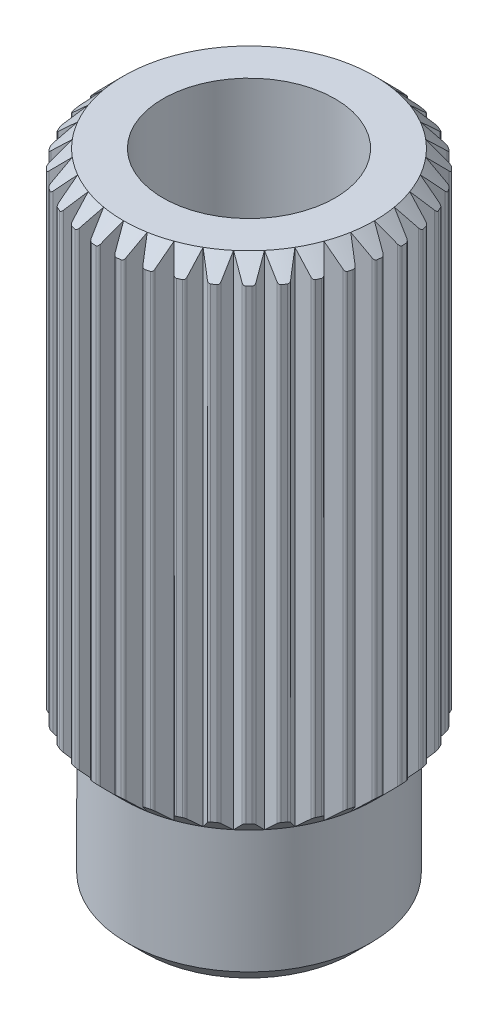
from build123d import *

# Parameters (mm, degrees)
SKETCH1_R                = 5
SKETCH1_R_2              = 3
BOSS_EXTRUDE1_DEPTH      = 22.5
SKETCH2_R                = 5
SKETCH2_R_2              = 4.25
CUT_EXTRUDE1_DEPTH       = 5
CHAMFER1_SIZE            = 0.625
CUT_EXTRUDE2_REACH       = 25.585
FILLET1_R                = 0.1
CIRPATTERN2_COUNT        = 36
FILLET1_OF_CIRPATTERN2_R = 0.1


with BuildPart() as part:
    # Sketch1 → Boss-Extrude1 (new body)
    with BuildSketch(Plane(origin=(0, 0, 0), x_dir=(1, 0, 0), z_dir=(0, 1, 0))):
        with Locations(Location((0, 0, 0), (0, 0, 90))):
            Circle(SKETCH1_R)
        with Locations(Location((0, 0, 0), (0, 0, 90))):
            Circle(SKETCH1_R_2, mode=Mode.SUBTRACT)
    extrude(amount=BOSS_EXTRUDE1_DEPTH)

    # Sketch2 → Cut-Extrude1 (cut)
    with BuildSketch(Plane.XZ):
        with Locations(Location((0, 0, 0), (0, 0, 270))):
            Circle(SKETCH2_R)
        with Locations(Location((0, 0, 0), (0, 0, 270))):
            Circle(SKETCH2_R_2, mode=Mode.SUBTRACT)
    extrude(amount=-CUT_EXTRUDE1_DEPTH, mode=Mode.SUBTRACT)

    # Chamfer1
    chamfer1_edges = [part.edges().sort_by_distance(p)[0] for p in [
        (0, 5, 5),
        (0, 0, 4.25),
        (0, 22.5, 5),
    ]]
    chamfer(chamfer1_edges, length=CHAMFER1_SIZE)

    # Cut-Extrude2: up to this cone (the profile starts inside it)
    cut_extrude2_end = Plane(origin=(0, 22.5, 0), z_dir=(0, 1, 0)).offset(-21.874999) * Cone(1e-06, 69.835, 69.834999, align=(Align.CENTER, Align.CENTER, Align.MIN), mode=Mode.PRIVATE)
    # Sketch3 → Cut-Extrude2 (cut, up to the surface)
    with BuildSketch(Plane(origin=(0, 22.5, 0), x_dir=(1, 0, 0), z_dir=(0, 1, 0)), mode=Mode.PRIVATE) as cut_extrude2_sk1:
        Polygon((0, 4.375), (0.329013253, 5.080571197), (-0.329013253, 5.080571197), align=None)
    cut_extrude2_tool1 = extrude(cut_extrude2_sk1.sketch, amount=-CUT_EXTRUDE2_REACH, mode=Mode.PRIVATE) & cut_extrude2_end
    cut_extrude2 = cut_extrude2_tool1.solids().sort_by_distance((0, 22.5, -4.845381))[0]
    add(cut_extrude2, mode=Mode.SUBTRACT)

    # Fillet1
    fillet1_edges = [part.edges().sort_by_distance(p)[0] for p in [
        (-0.287582554, 13.75, -4.991722776),
        (0.287582554, 13.75, -4.991722776),
    ]]
    fillet(fillet1_edges, radius=FILLET1_R)

    # CirPattern2: Cut-Extrude2 ×36 about axis
    cirpattern2_axis = Axis((0, 0, 0), (0, 1, 0))
    for i in range(1, CIRPATTERN2_COUNT):
        add(cut_extrude2.rotate(cirpattern2_axis, i * 360 / CIRPATTERN2_COUNT), mode=Mode.SUBTRACT)

    # Fillet1 of CirPattern2
    fillet1_of_cirpattern2_edges = [part.edges().sort_by_distance(p)[0] for p in [
        (-1.150017092, 13.75, -4.865949105),
        (-0.583590035, 13.75, -4.965825477),
        (-1.977508943, 13.75, -4.592326032),
        (-1.437030536, 13.75, -4.789044084),
        (-2.744915185, 13.75, -4.179167456),
        (-2.246807591, 13.75, -4.46675001),
        (-3.428918569, 13.75, -3.639026992),
        (-2.988316534, 13.75, -4.008735997),
        (-4.008735997, 13.75, -2.988316534),
        (-3.639026992, 13.75, -3.428918569),
        (-4.46675001, 13.75, -2.246807591),
        (-4.179167456, 13.75, -2.744915185),
        (-4.789044084, 13.75, -1.437030536),
        (-4.592326032, 13.75, -1.977508943),
        (-4.965825477, 13.75, -0.583590035),
        (-4.865949105, 13.75, -1.150017092),
        (-4.991722776, 13.75, 0.287582554),
        (-4.991722776, 13.75, -0.287582554),
        (-4.865949105, 13.75, 1.150017092),
        (-4.965825477, 13.75, 0.583590035),
        (-4.592326032, 13.75, 1.977508943),
        (-4.789044084, 13.75, 1.437030536),
        (-4.179167456, 13.75, 2.744915185),
        (-4.46675001, 13.75, 2.246807591),
        (-3.639026992, 13.75, 3.428918569),
        (-4.008735997, 13.75, 2.988316534),
        (-2.988316534, 13.75, 4.008735997),
        (-3.428918569, 13.75, 3.639026992),
        (-2.246807591, 13.75, 4.46675001),
        (-2.744915185, 13.75, 4.179167456),
        (-1.437030536, 13.75, 4.789044084),
        (-1.977508943, 13.75, 4.592326032),
        (-0.583590035, 13.75, 4.965825477),
        (-1.150017092, 13.75, 4.865949105),
        (0.287582554, 13.75, 4.991722776),
        (-0.287582554, 13.75, 4.991722776),
        (1.150017092, 13.75, 4.865949105),
        (0.583590035, 13.75, 4.965825477),
        (1.977508943, 13.75, 4.592326032),
        (1.437030536, 13.75, 4.789044084),
        (2.744915185, 13.75, 4.179167456),
        (2.246807591, 13.75, 4.46675001),
        (3.428918569, 13.75, 3.639026992),
        (2.988316534, 13.75, 4.008735997),
        (4.008735997, 13.75, 2.988316534),
        (3.639026992, 13.75, 3.428918569),
        (4.46675001, 13.75, 2.246807591),
        (4.179167456, 13.75, 2.744915185),
        (4.789044084, 13.75, 1.437030536),
        (4.592326032, 13.75, 1.977508943),
        (4.965825477, 13.75, 0.583590035),
        (4.865949105, 13.75, 1.150017092),
        (4.991722776, 13.75, -0.287582554),
        (4.991722776, 13.75, 0.287582554),
        (4.865949105, 13.75, -1.150017092),
        (4.965825477, 13.75, -0.583590035),
        (4.592326032, 13.75, -1.977508943),
        (4.789044084, 13.75, -1.437030536),
        (4.179167456, 13.75, -2.744915185),
        (4.46675001, 13.75, -2.246807591),
        (3.639026992, 13.75, -3.428918569),
        (4.008735997, 13.75, -2.988316534),
        (2.988316534, 13.75, -4.008735997),
        (3.428918569, 13.75, -3.639026992),
        (2.246807591, 13.75, -4.46675001),
        (2.744915185, 13.75, -4.179167456),
        (1.437030536, 13.75, -4.789044084),
        (1.977508943, 13.75, -4.592326032),
        (0.583590035, 13.75, -4.965825477),
        (1.150017092, 13.75, -4.865949105),
    ]]
    fillet(fillet1_of_cirpattern2_edges, radius=FILLET1_OF_CIRPATTERN2_R)


solid = part.part
